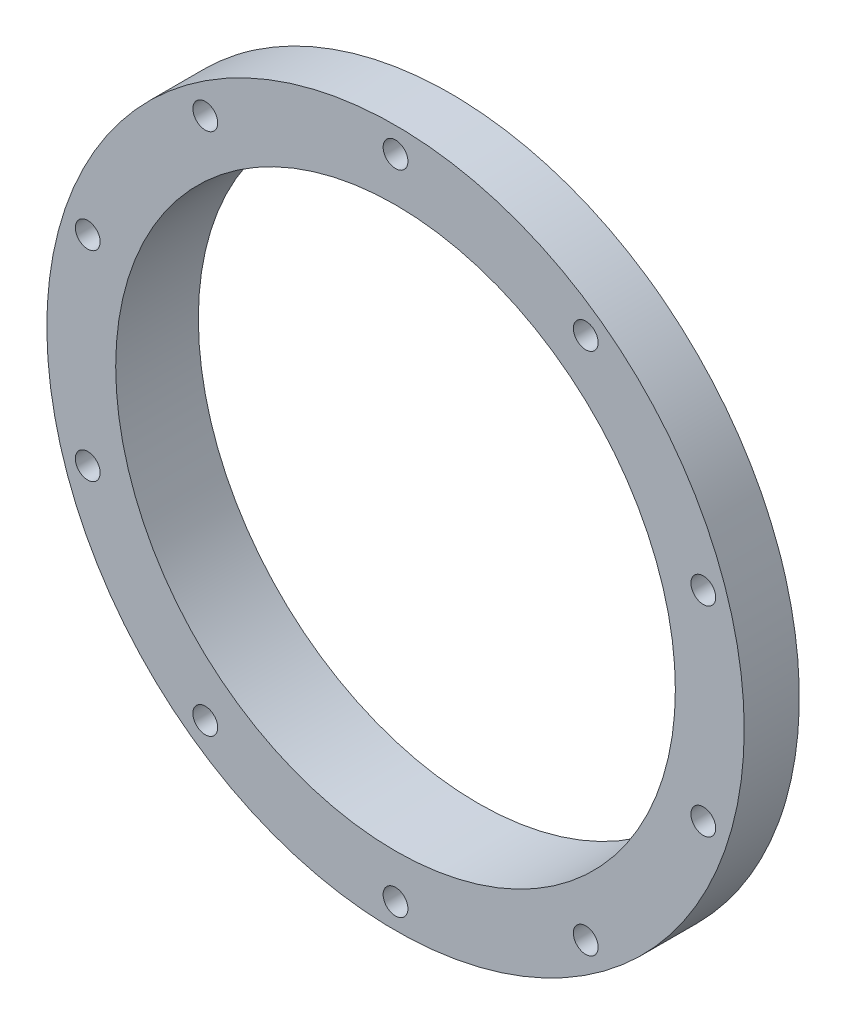
from build123d import *

# Parameters (mm, degrees)
SKETCH1_R           = 126.6
SKETCH1_R_2         = 101.6
BOSS_EXTRUDE1_DEPTH = 30
SKETCH10_R          = 4.5
CUT_EXTRUDE1_DEPTH  = 40
SKETCH11_R          = 10
CUT_EXTRUDE2_DEPTH  = 10
CIRPATTERN1_COUNT   = 10


with BuildPart() as part:
    # Sketch1 → Boss-Extrude1 (new body)
    with BuildSketch(Plane.XY):
        Circle(SKETCH1_R)
        Circle(SKETCH1_R_2, mode=Mode.SUBTRACT)
    extrude(amount=BOSS_EXTRUDE1_DEPTH)

    # Sketch5 → Cut-Revolve1 (revolve, cut)
    with BuildSketch(Plane(origin=(0, 0, 0), x_dir=(0, 0, -1), z_dir=(1, 0, 0)), mode=Mode.PRIVATE) as cut_revolve1_sk:
        Polygon((0, 126.6), (-10, 126.6), (0, 111.6), align=None)
    revolve(cut_revolve1_sk.sketch.rotate(Axis((0, 0, 30), (0, 0, -1)), 90), axis=Axis((0, 0, 30), (0, 0, -1)), mode=Mode.SUBTRACT)

    # Sketch10 → Cut-Extrude1 (cut)
    with BuildSketch(Plane(origin=(0, 0, 0), x_dir=(-1, 0, 0), z_dir=(0, 0, -1))):
        with Locations(Location((0, 117.5, 0), (0, 0, 312.023845203))):
            Circle(SKETCH10_R)
    cut_extrude1 = extrude(amount=-CUT_EXTRUDE1_DEPTH, mode=Mode.SUBTRACT)

    # Sketch11 → Cut-Extrude2 (cut)
    with BuildSketch(Plane(origin=(0, 0, 0), x_dir=(-1, 0, 0), z_dir=(0, 0, -1))):
        with Locations((0, 117.5)):
            Circle(SKETCH11_R)
    cut_extrude2 = extrude(amount=-CUT_EXTRUDE2_DEPTH, mode=Mode.SUBTRACT)

    # CirPattern1: Cut-Extrude1, Cut-Extrude2 ×10 about axis
    cirpattern1_axis = Axis((0, 0, 0), (0, 0, 1))
    add([cut_extrude1.rotate(cirpattern1_axis, i * 360 / CIRPATTERN1_COUNT) for i in range(1, CIRPATTERN1_COUNT)], mode=Mode.SUBTRACT)
    add([cut_extrude2.rotate(cirpattern1_axis, i * 360 / CIRPATTERN1_COUNT) for i in range(1, CIRPATTERN1_COUNT)], mode=Mode.SUBTRACT)


solid = part.part
